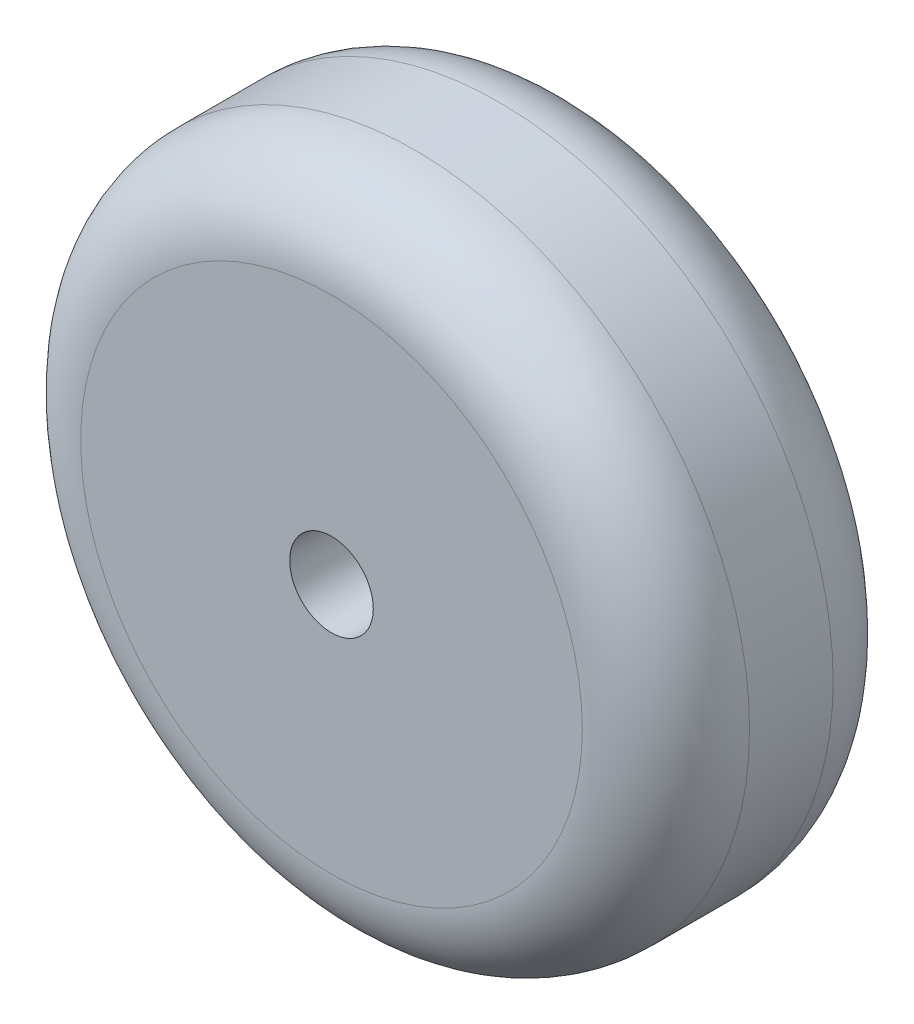
from build123d import *

# Parameters (mm, degrees)
SKETCH1_R               = 40
BOSS_EXTRUDE1_DEPTH     = 30
FILLET1_R               = 10
CUT_EXTRUDE1_DEPTH      = 65.031242437
CUT_EXTRUDE1_DEPTH_BACK = 65.031242437
SKETCH2_R               = 5


with BuildPart() as part:
    # Sketch1 → Boss-Extrude1 (new body)
    with BuildSketch(Plane.XY):
        Circle(SKETCH1_R)
    extrude(amount=BOSS_EXTRUDE1_DEPTH)

    # Fillet1
    fillet1_edges = [part.edges().sort_by_distance(p)[0] for p in [
        (-40, 0, 0),
        (-40, 0, 30),
    ]]
    fillet(fillet1_edges, radius=FILLET1_R)

    # Sketch2 → Cut-Extrude1 (cut, two sides: drawn at the far end of the back side and taken through both)
    with BuildSketch(Plane.XY.offset(30).offset(-CUT_EXTRUDE1_DEPTH_BACK)):
        Circle(SKETCH2_R)
    extrude(amount=CUT_EXTRUDE1_DEPTH + CUT_EXTRUDE1_DEPTH_BACK, mode=Mode.SUBTRACT)


solid = part.part
